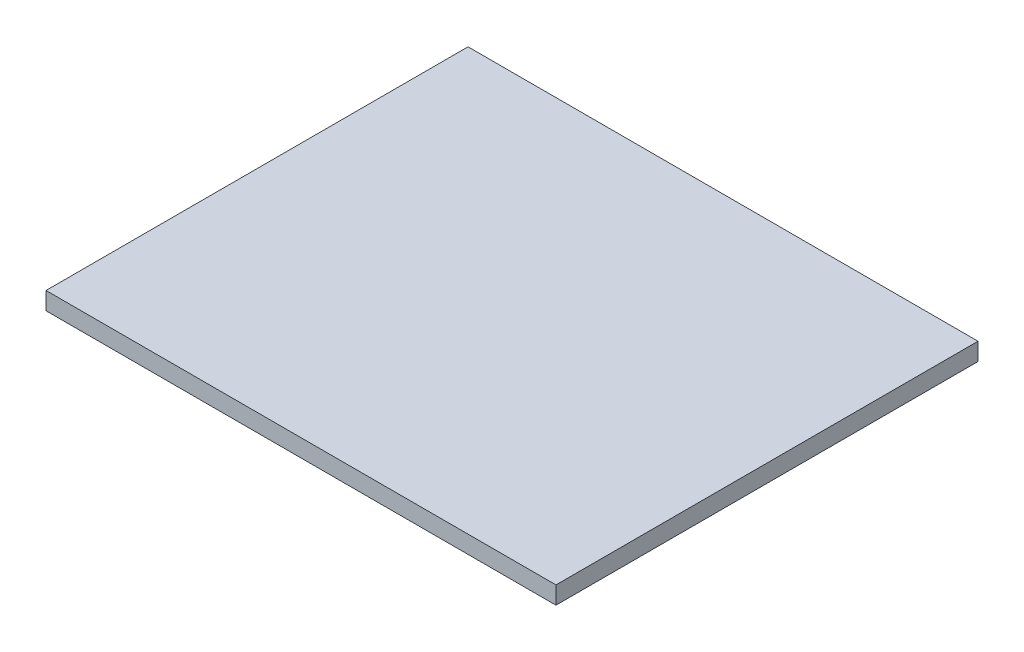
from build123d import *

# Parameters (mm, degrees)
SKETCH1_W           = 736.6
SKETCH1_H           = 609.6
BOSS_EXTRUDE1_DEPTH = 25.4


with BuildPart() as part:
    # Sketch1 → Boss-Extrude1 (new body)
    with BuildSketch(Plane(origin=(0, 0, 0), x_dir=(1, 0, 0), z_dir=(0, 1, 0))):
        with Locations((368.3, 304.8)):
            Rectangle(SKETCH1_W, SKETCH1_H)
    extrude(amount=BOSS_EXTRUDE1_DEPTH)


solid = part.part
